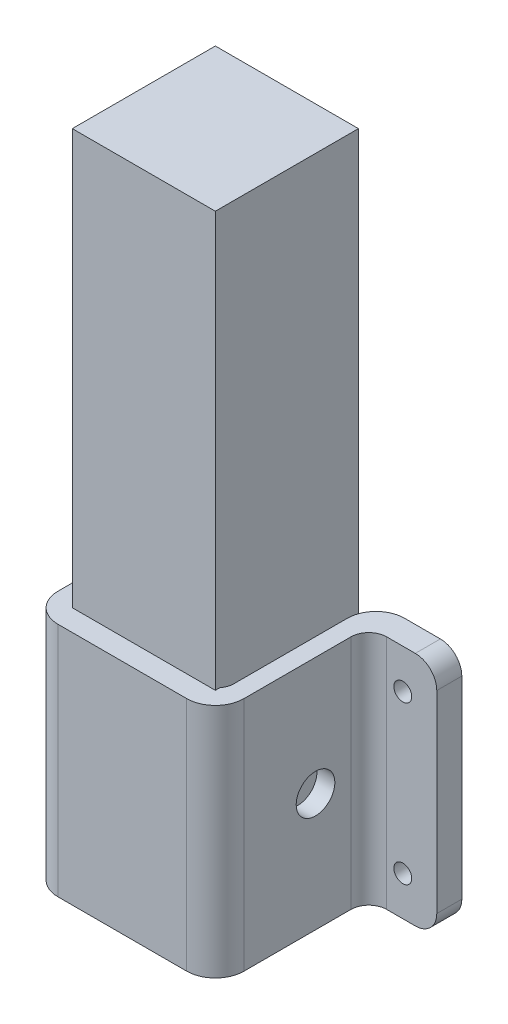
from build123d import *

# Parameters (mm, degrees)
SKETCH1_W                = 20
SKETCH1_H                = 91
ROD_DEPTH                = 20
SKETCH2_W                = 26
SKETCH2_H                = 33
BOSS_EXTRUDE3_DEPTH      = 3
SKETCH4_W                = 2.5
SKETCH4_H                = 33
BOSS_EXTRUDE4_DEPTH      = 20.2
BOSS_EXTRUDE5_DEPTH      = 1.75
BOSS_EXTRUDE5_DEPTH_BACK = 1.75
SKETCH5_W                = 12
SKETCH5_H                = 33
SKETCH8_R                = 1.25
CUT_EXTRUDE1_DEPTH       = 3.5
FILLET1_R                = 2.5
FILLET2_R                = 4
FILLET3_R                = 2
FILLET4_R                = 4
SKETCH9_R                = 2.7
SIDE_EXTRUDE_DEPTH       = 2.5
FILLET5_R                = 3


with BuildPart() as part:
    # Sketch1 → rod (new body)
    with BuildSketch(Plane.XY):
        with Locations((10, 45.5)):
            Rectangle(SKETCH1_W, SKETCH1_H)
    extrude(amount=-ROD_DEPTH)


with BuildPart() as body_2:
    # Sketch2 → Boss-Extrude3 (new body)
    with BuildSketch(Plane.XY):
        with Locations((10, 16.5)):
            Rectangle(SKETCH2_W, SKETCH2_H)
    extrude(amount=BOSS_EXTRUDE3_DEPTH)

    # Sketch4 → Boss-Extrude4 (add)
    with BuildSketch(Plane.XY):
        with Locations((21.75, 16.5)):
            Rectangle(SKETCH4_W, SKETCH4_H)
        with Locations((-1.75, 16.5)):
            Rectangle(SKETCH4_W, SKETCH4_H)
    extrude(amount=-BOSS_EXTRUDE4_DEPTH)

    # Sketch5 → Boss-Extrude5 (add, two sides: drawn at the far end of the back side and taken through both)
    with BuildSketch(Plane.XY.offset(-20.2).offset(-BOSS_EXTRUDE5_DEPTH_BACK)):
        with Locations((26.5, 16.5)):
            Rectangle(SKETCH5_W, SKETCH5_H)
        with Locations((-6.5, 16.5)):
            Rectangle(SKETCH5_W, SKETCH5_H)
    extrude(amount=BOSS_EXTRUDE5_DEPTH + BOSS_EXTRUDE5_DEPTH_BACK)

    # Sketch8 → Cut-Extrude1 (cut)
    with BuildSketch(Plane.XY.offset(-18.45)):
        with Locations((27.75, 27.5)):
            Circle(SKETCH8_R)
        with Locations((27.75, 5.5)):
            Circle(SKETCH8_R)
    cut_extrude1 = extrude(amount=-CUT_EXTRUDE1_DEPTH, mode=Mode.SUBTRACT)

    # Mirror1: Cut-Extrude1 across plane
    add(cut_extrude1.mirror(Plane(origin=(10, 0, 0), x_dir=(0, 0, 1), z_dir=(1, 0, 0))), mode=Mode.SUBTRACT)

    # Fillet1
    fillet1_edges = [body_2.edges().sort_by_distance(p)[0] for p in [
        (23, 16.5, -18.45),
        (-3, 16.5, -18.45),
    ]]
    fillet(fillet1_edges, radius=FILLET1_R)

    # Fillet2
    fillet2_edges = [body_2.edges().sort_by_distance(p)[0] for p in [
        (-3, 16.5, 3),
        (23, 16.5, 3),
    ]]
    fillet(fillet2_edges, radius=FILLET2_R)

    # Fillet3
    fillet3_edges = [body_2.edges().sort_by_distance(p)[0] for p in [
        (20.5, 16.5, 0),
        (-0.5, 16.5, 0),
    ]]
    fillet(fillet3_edges, radius=FILLET3_R)

    # Fillet4
    fillet4_edges = [body_2.edges().sort_by_distance(p)[0] for p in [
        (20.5, 16.5, -21.95),
        (-0.5, 16.5, -21.95),
    ]]
    fillet(fillet4_edges, radius=FILLET4_R)

    # Sketch9 → Side Extrude (cut)
    with BuildSketch(Plane.ZY.offset(3)):
        with Locations(Location((-11, 16.5, 0), (0, 0, 270))):
            Circle(SKETCH9_R)
    side_extrude = extrude(amount=-SIDE_EXTRUDE_DEPTH, mode=Mode.SUBTRACT)

    # Mirror2: Side Extrude across plane
    add(side_extrude.mirror(Plane(origin=(10, 0, 0), x_dir=(0, 0, 1), z_dir=(1, 0, 0))), mode=Mode.SUBTRACT)

    # Fillet5
    fillet5_edges = [body_2.edges().sort_by_distance(p)[0] for p in [
        (32.5, 0, -20.2),
        (32.5, 33, -20.2),
        (-12.5, 0, -20.2),
        (-12.5, 33, -20.2),
    ]]
    fillet(fillet5_edges, radius=FILLET5_R)


solid = Compound([part.part, body_2.part])
